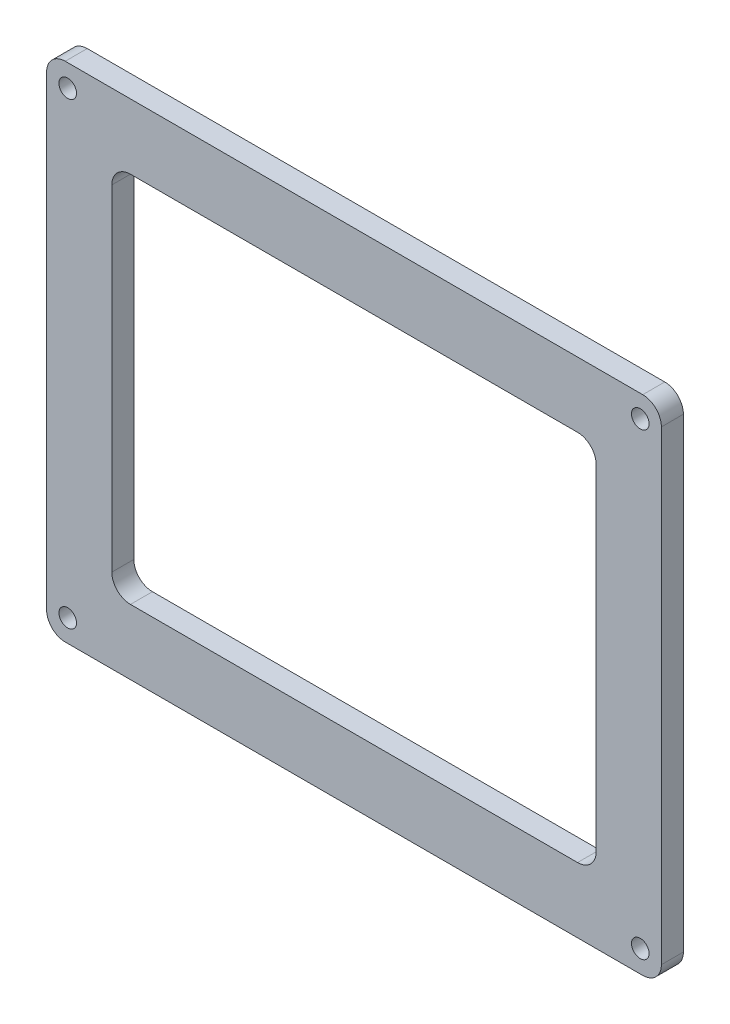
from build123d import *

# Parameters (mm, degrees)
BOSS_EXTRUDE1_DEPTH = 3


with BuildPart() as part:
    # Sketch1 → Boss-Extrude1 (new body)
    with BuildSketch(Plane.XY):
        with BuildLine():
            Line((39.37, 34.29), (-39.37, 34.29))
            ThreePointArc((-39.37, 34.29), (-41.166051224, 33.546051224), (-41.91, 31.75))
            Line((-41.91, 31.75), (-41.91, -31.75))
            ThreePointArc((-41.91, -31.75), (-41.166051224, -33.546051224), (-39.37, -34.29))
            Line((-39.37, -34.29), (39.37, -34.29))
            ThreePointArc((39.37, -34.29), (41.166051224, -33.546051224), (41.91, -31.75))
            Line((41.91, -31.75), (41.91, 31.75))
            ThreePointArc((41.91, 31.75), (41.166051224, 33.546051224), (39.37, 34.29))
        make_face()
        with BuildLine():
            Line((-30.48, 25.4), (30.48, 25.4))
            ThreePointArc((30.48, 25.4), (32.276051224, 24.656051224), (33.02, 22.86))
            Line((33.02, 22.86), (33.02, -22.86))
            ThreePointArc((33.02, -22.86), (32.276051224, -24.656051224), (30.48, -25.4))
            Line((30.48, -25.4), (-30.48, -25.4))
            ThreePointArc((-30.48, -25.4), (-32.276051224, -24.656051224), (-33.02, -22.86))
            Line((-33.02, -22.86), (-33.02, 22.86))
            ThreePointArc((-33.02, 22.86), (-32.276051224, 24.656051224), (-30.48, 25.4))
        make_face(mode=Mode.SUBTRACT)
    extrude(amount=BOSS_EXTRUDE1_DEPTH)

    # Sketch3 → M2 Clearance Hole1 (revolve, cut)
    with BuildSketch(Plane(origin=(-39.033101712, 31.267063068, 3), x_dir=(0, -1, 0), z_dir=(1, 0, 0))):
        Polygon((0, 0), (0, 3.769032743), (1.2, 3.048), (1.2, 0), align=None)
    m2_clearance_hole1 = revolve(axis=Axis((-39.033101712, 31.267063068, 9.35), (0, 0, -1)), mode=Mode.SUBTRACT)

    # Mirror1: M2 Clearance Hole1 across plane
    add(m2_clearance_hole1.mirror(Plane.ZX), mode=Mode.SUBTRACT)

    # Mirror2: M2 Clearance Hole1 across plane
    add(m2_clearance_hole1.mirror(Plane(origin=(0, 0, 0), x_dir=(0, 0, 1), z_dir=(1, 0, 0))), mode=Mode.SUBTRACT)

    # Mirror2 copy 1 sketch → Mirror2 copy 1 (revolve, cut)
    with BuildSketch(Plane(origin=(39.033101712, -31.267063068, 3), x_dir=(0, 1, 0), z_dir=(-1, 0, 0))):
        Polygon((0, 0), (0, 3.769032743), (1.2, 3.048), (1.2, 0), align=None)
    revolve(axis=Axis((39.033101712, -31.267063068, 9.35), (0, 0, -1)), mode=Mode.SUBTRACT)


solid = part.part
